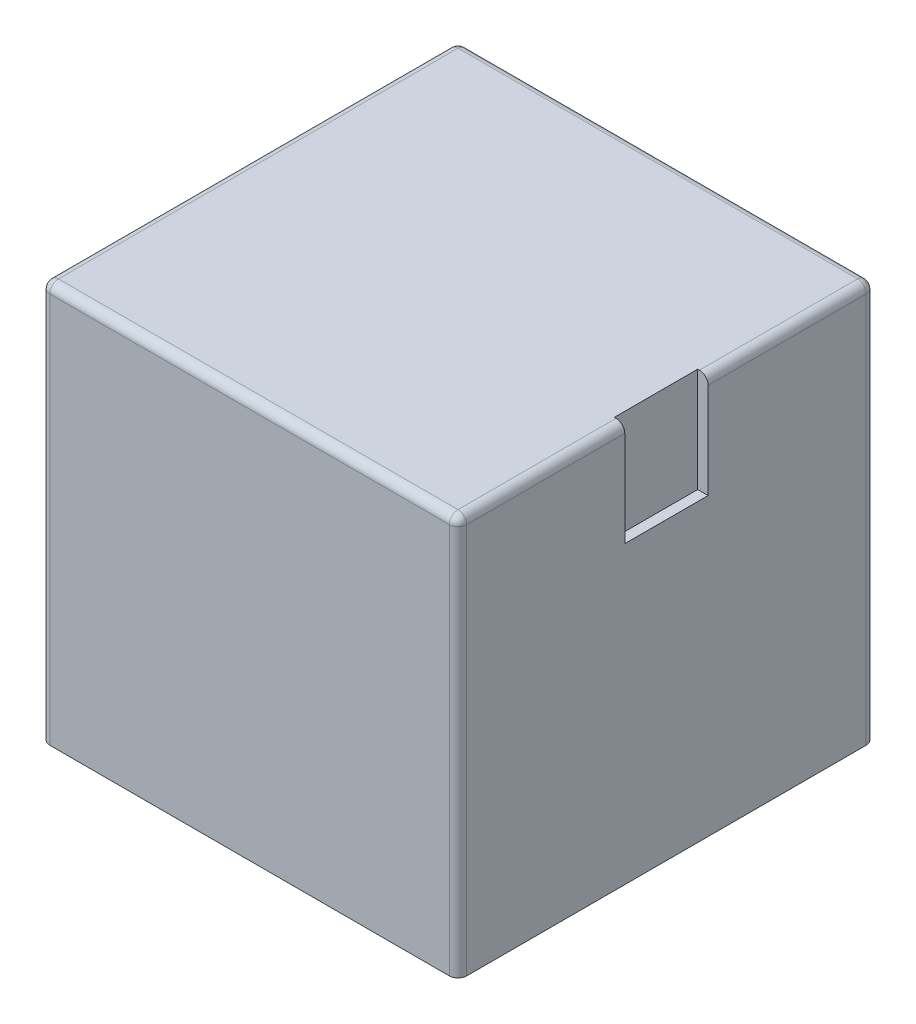
from build123d import *

# Parameters (mm, degrees)
SKETCH1_W           = 120
SKETCH1_H           = 120
BOSS_EXTRUDE1_DEPTH = 115
SKETCH2_W           = 110
SKETCH2_H           = 110
CUT_EXTRUDE1_DEPTH  = 110
SKETCH4_W           = 24
SKETCH4_H           = 30
CUT_EXTRUDE3_DEPTH  = 3
SKETCH6_R           = 7.75
CUT_EXTRUDE5_DEPTH  = 6
SKETCH9_W           = 30
SKETCH9_H           = 35
BOSS_EXTRUDE2_DEPTH = 3
FILLET2_R           = 2.5
SKETCH12_W          = 40
SKETCH12_H          = 50
CUT_EXTRUDE8_DEPTH  = 5
SKETCH13_W          = 50
SKETCH13_H          = 60
CUT_EXTRUDE9_DEPTH  = 3
SKETCH14_W          = 40
SKETCH14_H          = 60
CUT_EXTRUDE10_DEPTH = 3


with BuildPart() as part:
    # Sketch1 → Boss-Extrude1 (new body)
    with BuildSketch(Plane(origin=(0, 0, 0), x_dir=(1, 0, 0), z_dir=(0, 1, 0))):
        with Locations((0.113396959, 0)):
            Rectangle(SKETCH1_W, SKETCH1_H)
    extrude(amount=BOSS_EXTRUDE1_DEPTH)

    # Sketch2 → Cut-Extrude1 (cut)
    with BuildSketch(Plane.XZ):
        with Locations((0.113396959, 0)):
            Rectangle(SKETCH2_W, SKETCH2_H)
    extrude(amount=-CUT_EXTRUDE1_DEPTH, mode=Mode.SUBTRACT)

    # Sketch4 → Cut-Extrude3 (cut)
    with BuildSketch(Plane(origin=(60.113396959, 0, 0), x_dir=(0, 0, -1), z_dir=(1, 0, 0))):
        with Locations((0, 100)):
            Rectangle(SKETCH4_W, SKETCH4_H)
    extrude(amount=-CUT_EXTRUDE3_DEPTH, mode=Mode.SUBTRACT)

    # Sketch6 → Cut-Extrude5 (cut)
    with BuildSketch(Plane(origin=(0, 0, -60), x_dir=(-1, 0, 0), z_dir=(0, 0, -1))):
        with Locations((-35.113396959, 90)):
            Circle(SKETCH6_R)
    extrude(amount=-CUT_EXTRUDE5_DEPTH, mode=Mode.SUBTRACT)

    # Sketch9 → Boss-Extrude2 (add)
    with BuildSketch(Plane.ZY.offset(-55.113396959)):
        with Locations((0, 92.5)):
            Rectangle(SKETCH9_W, SKETCH9_H)
    extrude(amount=BOSS_EXTRUDE2_DEPTH)

    # Fillet2
    fillet2_edges = [part.edges().sort_by_distance(p)[0] for p in [
        (60.113396959, 115, 36),
        (0.113396959, 115, -60),
        (60.113396959, 115, -36),
        (-59.886603041, 115, 0),
        (0.113396959, 115, 60),
        (-59.886603041, 57.5, -60),
        (60.113396959, 57.5, -60),
        (60.113396959, 57.5, 60),
        (-59.886603041, 57.5, 60),
    ]]
    fillet(fillet2_edges, radius=FILLET2_R)

    # Sketch12 → Cut-Extrude8 (cut)
    with BuildSketch(Plane.ZY.offset(59.886603041)):
        with Locations((20, 75)):
            Rectangle(SKETCH12_W, SKETCH12_H)
    extrude(amount=-CUT_EXTRUDE8_DEPTH, mode=Mode.SUBTRACT)

    # Sketch13 → Cut-Extrude9 (cut)
    with BuildSketch(Plane.ZY.offset(59.886603041)):
        with Locations((20, 75)):
            Rectangle(SKETCH13_W, SKETCH13_H)
    extrude(amount=-CUT_EXTRUDE9_DEPTH, mode=Mode.SUBTRACT)

    # Sketch14 → Cut-Extrude10 (cut)
    with BuildSketch(Plane.ZY.offset(59.886603041)):
        with Locations((-30, 75)):
            Rectangle(SKETCH14_W, SKETCH14_H)
    extrude(amount=-CUT_EXTRUDE10_DEPTH, mode=Mode.SUBTRACT)


solid = part.part
